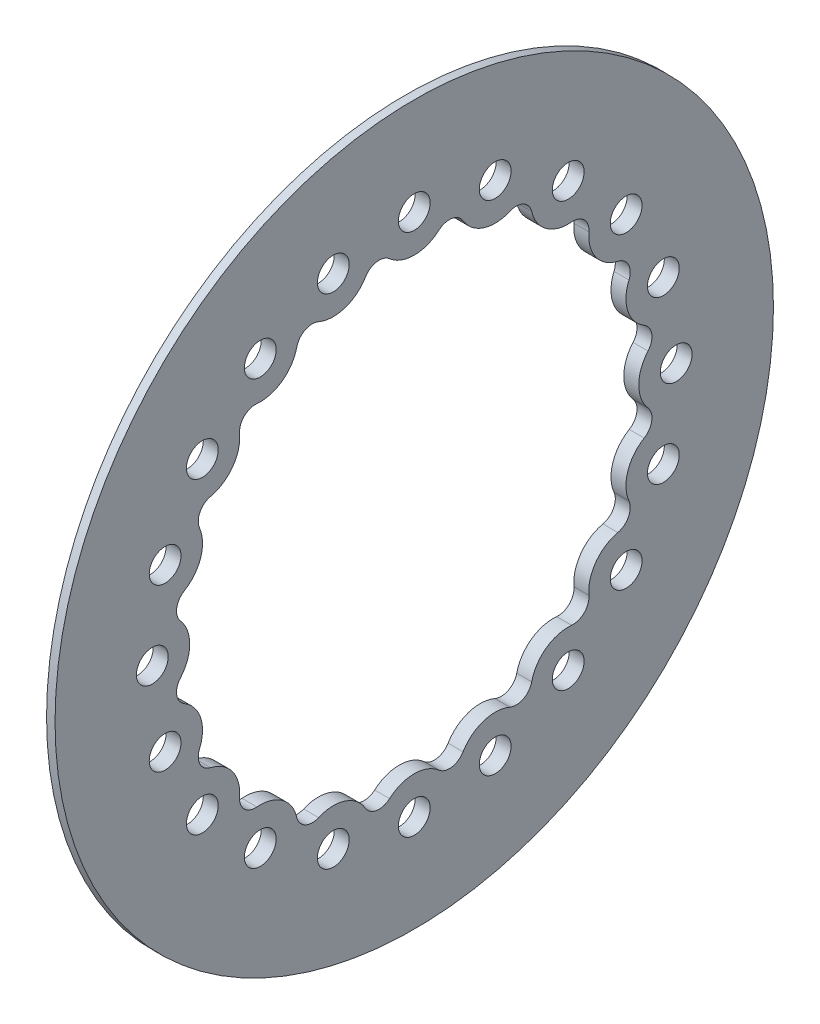
from build123d import *

# Parameters (mm, degrees)
SKETCH1_R           = 96
SKETCH1_R_2         = 60
BOSS_EXTRUDE1_DEPTH = 2
SKETCH2_R           = 4.25
CUT_EXTRUDE1_DEPTH  = 136.823414771
CIRPATTERN1_COUNT   = 20
CHAMFER1_SIZE       = 3
CHAMFER1_SIZE2      = 1.732050808


with BuildPart() as part:
    # Sketch1 → Boss-Extrude1 (new, symmetric)
    with BuildSketch(Plane(origin=(0, 0, 0), x_dir=(0, 0, -1), z_dir=(1, 0, 0))):
        Circle(SKETCH1_R)
        Circle(SKETCH1_R_2, mode=Mode.SUBTRACT)
    extrude(amount=BOSS_EXTRUDE1_DEPTH, both=True)

    # Sketch2 → Cut-Extrude1 (cut, through all)
    with BuildSketch(Plane(origin=(2, 0, 0), x_dir=(0, 0, -1), z_dir=(1, 0, 0))):
        with Locations((0, 70)):
            Circle(SKETCH2_R)
        with BuildLine():
            Line((10.490232723, 55.175649906), (-0.23164627, 55.175649906))
            Line((-0.23164627, 55.175649906), (-10.490232723, 55.175649906))
            ThreePointArc((-10.490232723, 55.175649906), (-13.137614633, 61.283337309), (-6.588851569, 62.477564557))
            ThreePointArc((-6.588851569, 62.477564557), (0, 60), (6.588851569, 62.477564557))
            ThreePointArc((6.588851569, 62.477564557), (13.137614633, 61.283337309), (10.490232723, 55.175649906))
        make_face()
    cut_extrude1 = extrude(amount=-CUT_EXTRUDE1_DEPTH, mode=Mode.SUBTRACT)

    # CirPattern1: Cut-Extrude1 ×20 about axis
    cirpattern1_axis = Axis((2, 0, 0), (-1, 0, 0))
    for i in range(1, CIRPATTERN1_COUNT):
        add(cut_extrude1.rotate(cirpattern1_axis, i * 360 / CIRPATTERN1_COUNT), mode=Mode.SUBTRACT)

    # Chamfer1
    chamfer1_edges = [part.edges().sort_by_distance(p)[0] for p in [
        (-2, 0, 96),
    ]]
    chamfer1_side = [part.faces().sort_by_distance(p)[0] for p in [
        (-2, 0, 93.28470996),
    ]]
    chamfer(chamfer1_edges, length=CHAMFER1_SIZE, length2=CHAMFER1_SIZE2, reference=chamfer1_side[0])


solid = part.part
